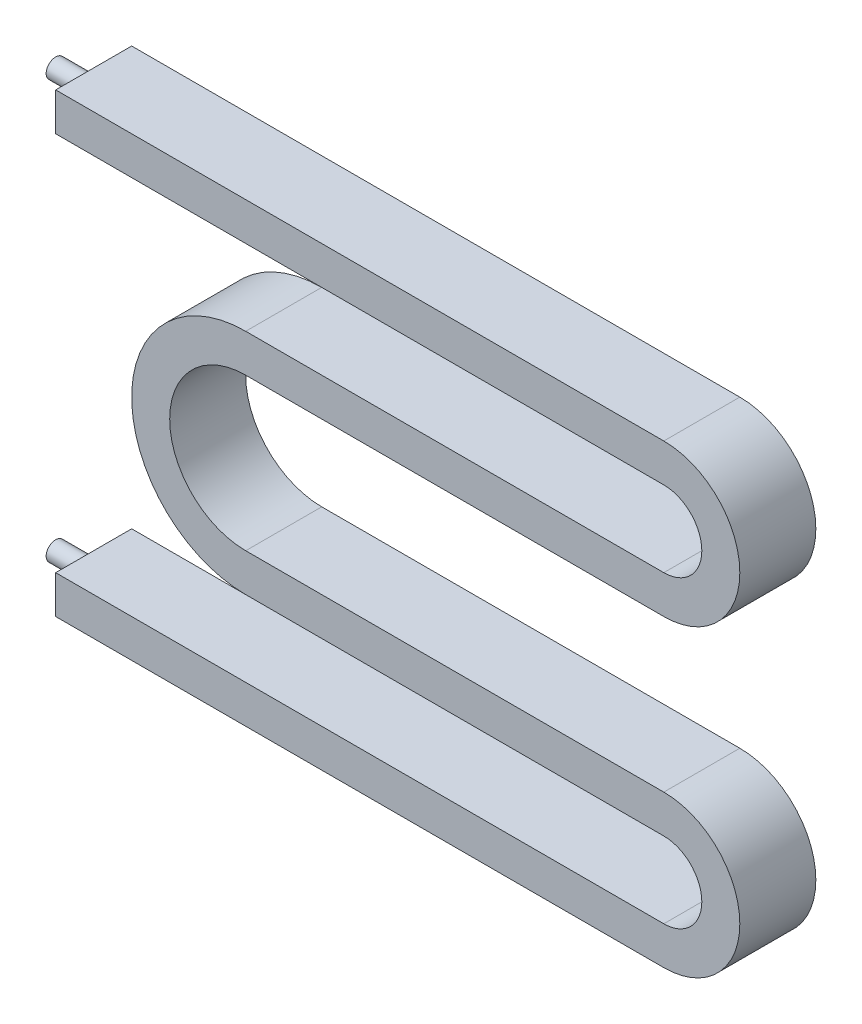
from build123d import *

# Parameters (mm, degrees)
BOSS_EXTRUDE1_DEPTH = 10
SKETCH2_R           = 1.25
BOSS_EXTRUDE2_DEPTH = 5
SKETCH3_R           = 1.25
BOSS_EXTRUDE3_DEPTH = 5


with BuildPart() as part:
    # Sketch1 → Boss-Extrude1 (new body)
    with BuildSketch(Plane.XY):
        with BuildLine():
            Line((0, 0), (80, 0))
            ThreePointArc((80, 0), (90, -10), (80, -20))
            Line((80, -20), (25, -20))
            ThreePointArc((25, -20), (15, -30), (25, -40))
            Line((25, -40), (80, -40))
            ThreePointArc((80, -40), (90, -50), (80, -60))
            Line((80, -60), (0, -60))
            Line((0, -60), (0, -55))
            Line((0, -55), (80, -55))
            ThreePointArc((80, -55), (85, -50), (80, -45))
            Line((80, -45), (25, -45))
            ThreePointArc((25, -45), (10, -30), (25, -15))
            Line((25, -15), (80, -15))
            ThreePointArc((80, -15), (85, -10), (80, -5))
            Line((80, -5), (0, -5))
            Line((0, -5), (0, 0))
        make_face()
    extrude(amount=BOSS_EXTRUDE1_DEPTH)

    # Sketch2 → Boss-Extrude2 (add)
    with BuildSketch(Plane.ZY):
        with Locations(Location((5, -2.5, 0), (0, 0, 180))):
            Circle(SKETCH2_R)
    extrude(amount=BOSS_EXTRUDE2_DEPTH)

    # Sketch3 → Boss-Extrude3 (add)
    with BuildSketch(Plane.ZY):
        with Locations(Location((5, -57.5, 0), (0, 0, 180))):
            Circle(SKETCH3_R)
    extrude(amount=BOSS_EXTRUDE3_DEPTH)


solid = part.part
